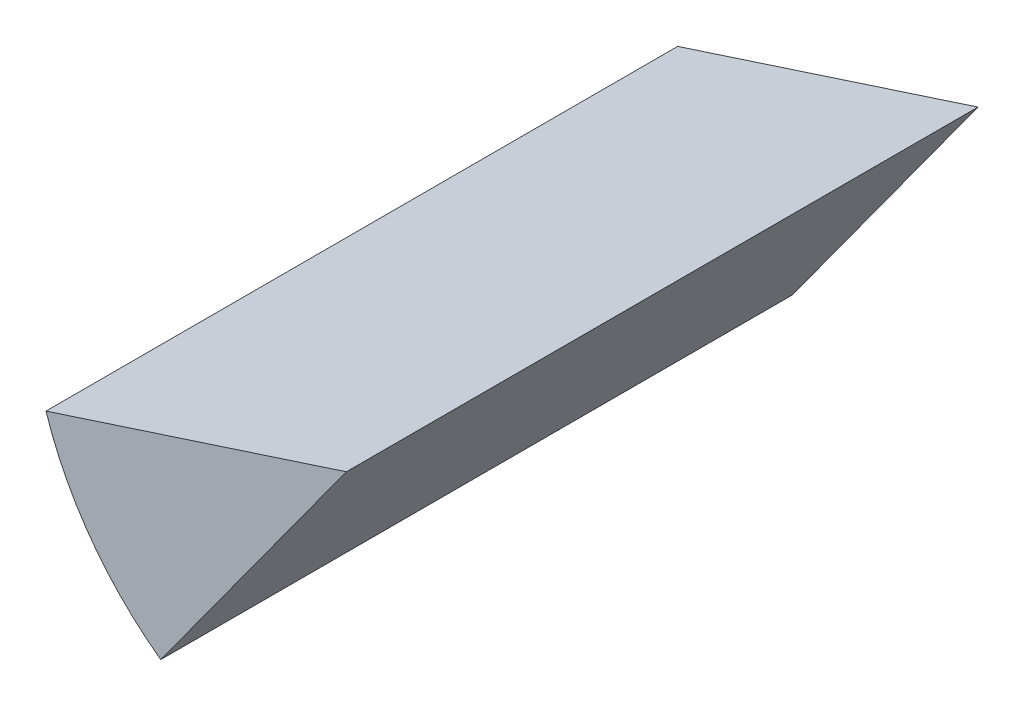
from build123d import *

# Parameters (mm, degrees)
SALIENTE_EXTRUIR1_DEPTH = 50
CROQUIS2_R              = 5
CORTAR_EXTRUIR1_DEPTH   = 10


with BuildPart() as part:
    # Croquis1 → Saliente-Extruir1 (new body)
    with BuildSketch(Plane.XY):
        with BuildLine():
            Line((0, 0), (-23.776412907, -7.725424859))
            ThreePointArc((-23.776412907, -7.725424859), (-20.225424859, -14.694631307), (-14.694631307, -20.225424859))
            Line((-14.694631307, -20.225424859), (0, 0))
        make_face()
    extrude(amount=SALIENTE_EXTRUIR1_DEPTH)

    # Croquis2 → Cortar-Extruir1 (cut)
    with BuildSketch(Plane(origin=(0, 0, 0), x_dir=(-1, 0, 0), z_dir=(0, 0, -1))):
        with Locations((15.335063594, -10.805161409)):
            Circle(CROQUIS2_R)
    extrude(amount=-CORTAR_EXTRUIR1_DEPTH, mode=Mode.SUBTRACT)


solid = part.part
